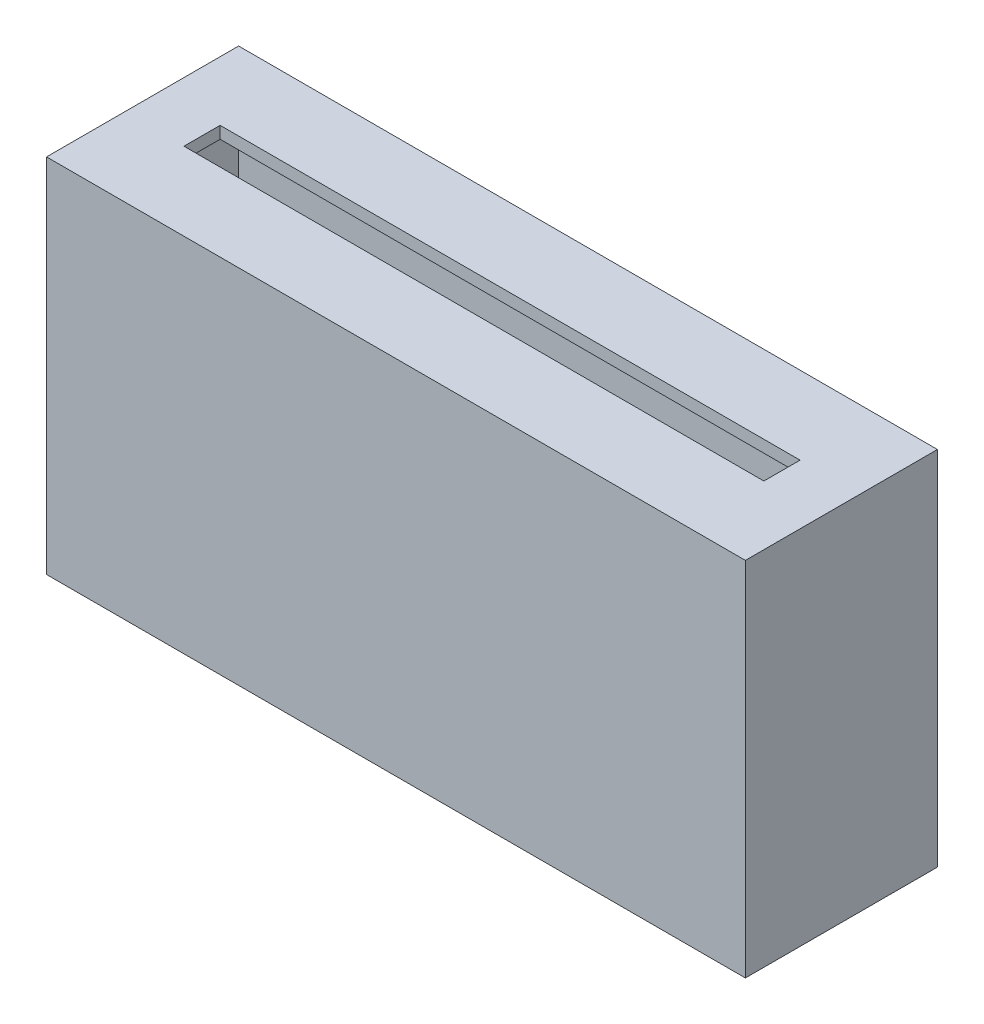
from build123d import *

# Parameters (mm, degrees)
SKETCH1_W           = 147.22869713
SKETCH1_H           = 40.463516098
BOSS_EXTRUDE1_DEPTH = 76.2
SHELL1_T            = -2.54
SKETCH2_W           = 122.174
SKETCH2_H           = 7.62
CUT_EXTRUDE1_DEPTH  = 2.54


with BuildPart() as part:
    # Sketch1 → Boss-Extrude1 (new body)
    with BuildSketch(Plane(origin=(0, 0, 0), x_dir=(1, 0, 0), z_dir=(0, 1, 0))):
        Rectangle(SKETCH1_W, SKETCH1_H)
    extrude(amount=BOSS_EXTRUDE1_DEPTH)

    # Shell1
    shell1_openings = [part.faces().sort_by_distance(p)[0] for p in [
        (0, 0, 0),
    ]]
    offset(amount=SHELL1_T, openings=shell1_openings, kind=Kind.INTERSECTION)

    # Sketch2 → Cut-Extrude1 (cut)
    with BuildSketch(Plane(origin=(0, 76.2, 0), x_dir=(1, 0, 0), z_dir=(0, 1, 0))):
        Rectangle(SKETCH2_W, SKETCH2_H)
    extrude(amount=-CUT_EXTRUDE1_DEPTH, mode=Mode.SUBTRACT)


solid = part.part
